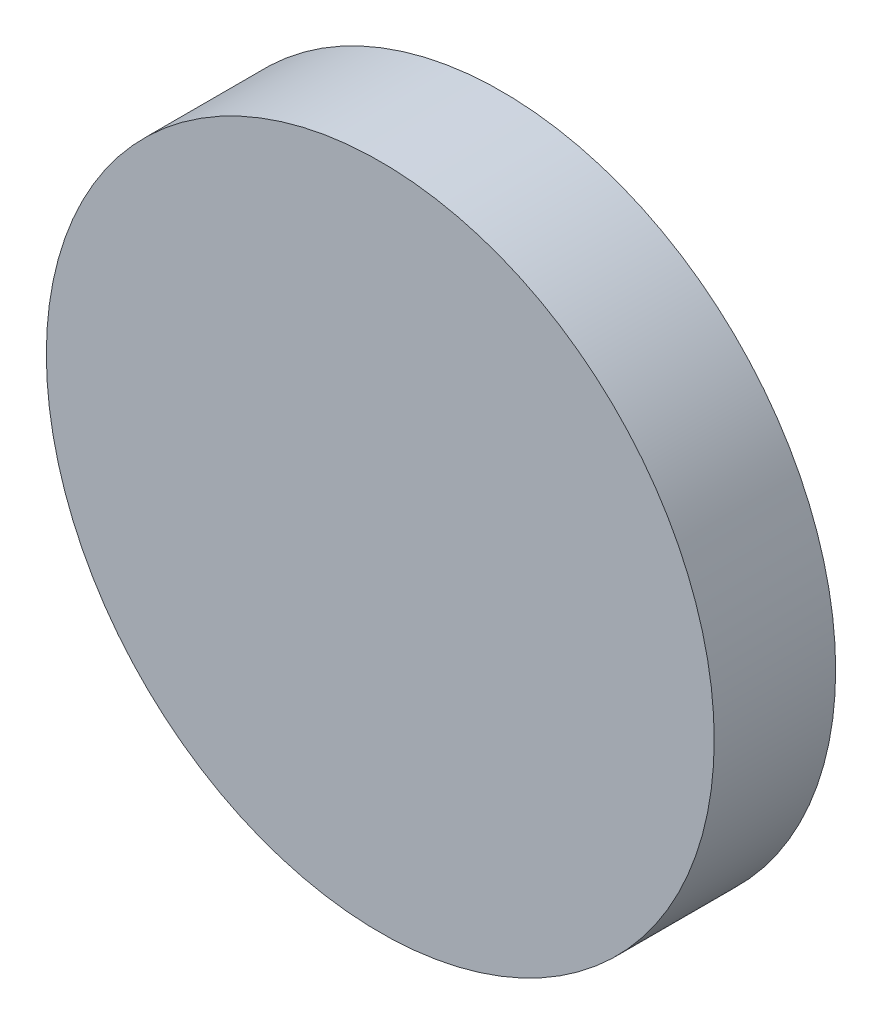
from build123d import *

# Parameters (mm, degrees)
SKETCH1_R           = 5500
BOSS_EXTRUDE1_DEPTH = 1000


with BuildPart() as part:
    # Sketch1 → Boss-Extrude1 (new, symmetric)
    with BuildSketch(Plane.XY):
        Circle(SKETCH1_R)
    extrude(amount=BOSS_EXTRUDE1_DEPTH, both=True)


solid = part.part
